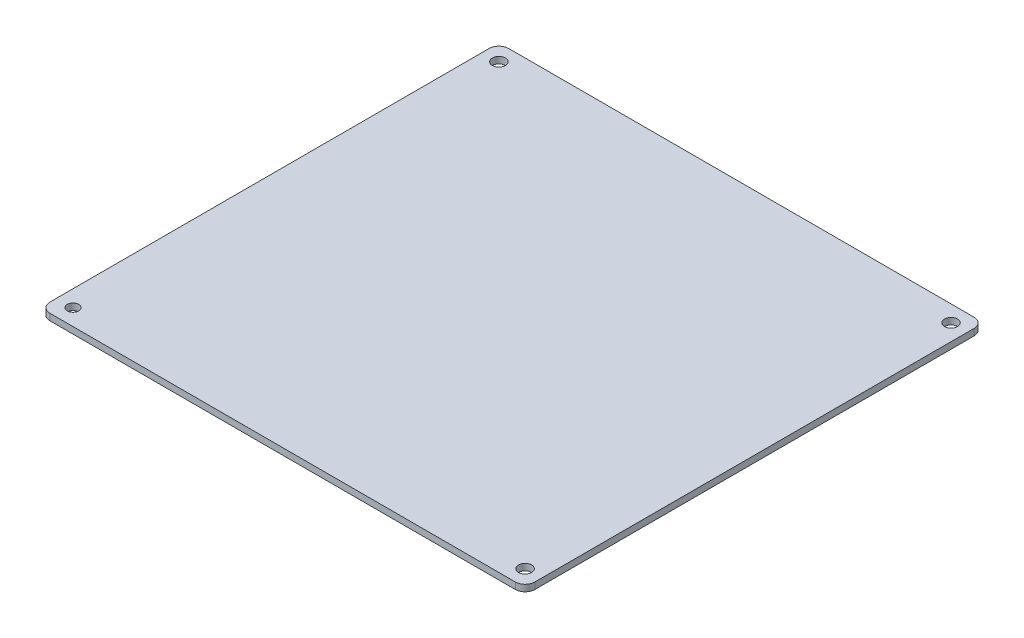
from build123d import *

# Parameters (mm, degrees)
SKETCH1_W           = 148
SKETCH1_H           = 140
BOSS_EXTRUDE1_DEPTH = 2
SKETCH2_R           = 2
SKETCH2_R_2         = 1.73874997
CUT_EXTRUDE1_DEPTH  = 5
FILLET1_R           = 3
FILLET2_R           = 3
FILLET3_R           = 3
FILLET4_R           = 3


with BuildPart() as part:
    # Sketch1 → Boss-Extrude1 (new body)
    with BuildSketch(Plane(origin=(0, 0, 0), x_dir=(1, 0, 0), z_dir=(0, 1, 0))):
        with Locations((12.91414701, 67.76397383)):
            Rectangle(SKETCH1_W, SKETCH1_H)
    extrude(amount=BOSS_EXTRUDE1_DEPTH)

    # Sketch2 → Cut-Extrude1 (cut)
    with BuildSketch(Plane(origin=(0, 2, 0), x_dir=(1, 0, 0), z_dir=(0, 1, 0))):
        with Locations(Location((-56.08585299, 132.76397383, 0), (0, 0, 270))):
            Circle(SKETCH2_R)
        with Locations(Location((81.91414701, 132.76397383, 0), (0, 0, 270))):
            Circle(SKETCH2_R)
        with Locations(Location((81.91414701, 2.76397383, 0), (0, 0, 270))):
            Circle(SKETCH2_R)
        with Locations(Location((-56.08585299, 2.76397383, 0), (0, 0, 270))):
            Circle(SKETCH2_R_2)
    extrude(amount=-CUT_EXTRUDE1_DEPTH, mode=Mode.SUBTRACT)

    # Fillet1
    fillet1_edges = [part.edges().sort_by_distance(p)[0] for p in [
        (86.91414701, 1, 2.23602617),
    ]]
    fillet(fillet1_edges, radius=FILLET1_R)

    # Fillet2
    fillet2_edges = [part.edges().sort_by_distance(p)[0] for p in [
        (86.91414701, 1, -137.76397383),
    ]]
    fillet(fillet2_edges, radius=FILLET2_R)

    # Fillet3
    fillet3_edges = [part.edges().sort_by_distance(p)[0] for p in [
        (-61.08585299, 1, -137.76397383),
    ]]
    fillet(fillet3_edges, radius=FILLET3_R)

    # Fillet4
    fillet4_edges = [part.edges().sort_by_distance(p)[0] for p in [
        (-61.08585299, 1, 2.23602617),
    ]]
    fillet(fillet4_edges, radius=FILLET4_R)


solid = part.part
